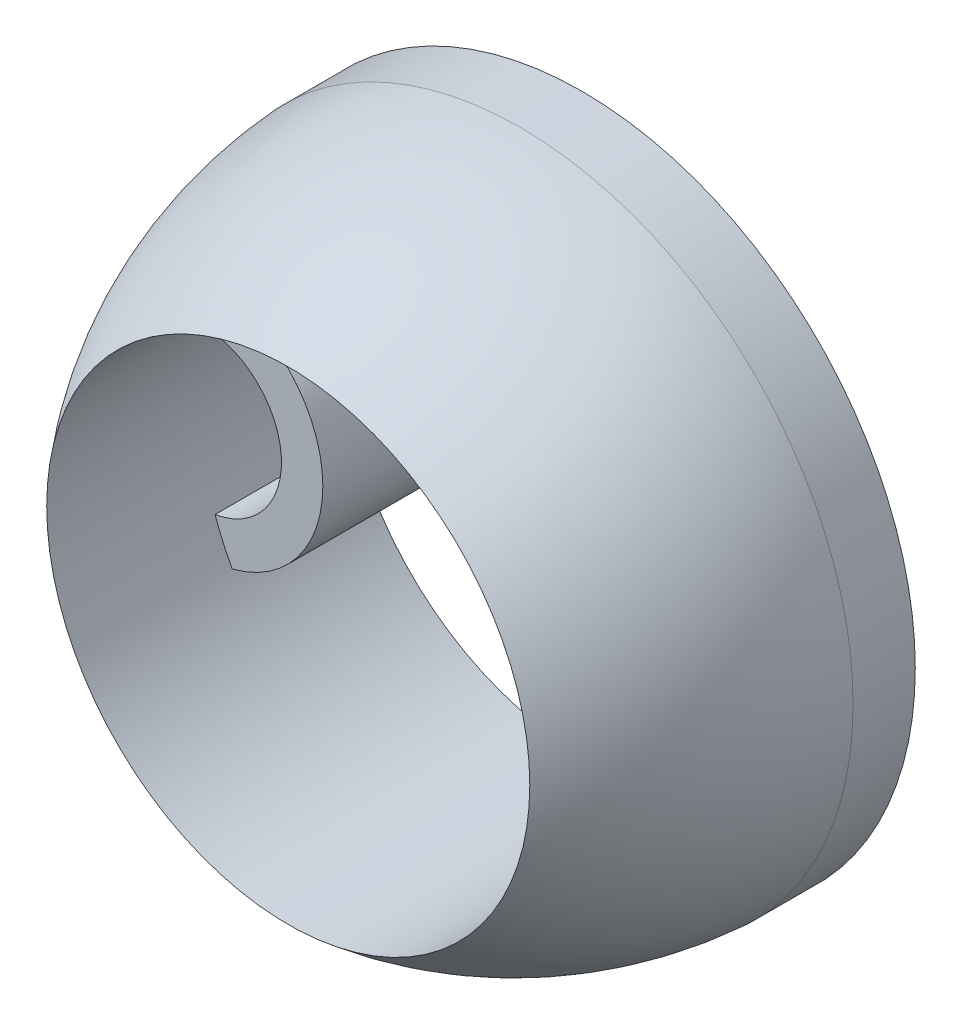
from build123d import *

# Parameters (mm, degrees)
SKETCH4_R           = 14.82725
CUT_EXTRUDE2_DEPTH  = 47.51766397
EXTRUDE_THIN1_DEPTH = 8.509


with BuildPart() as part:
    # Sketch1 → Revolve1 (revolve)
    with BuildSketch(Plane(origin=(0, 0, 0), x_dir=(1, 0, 0), z_dir=(0, 1, 0))):
        with BuildLine():
            Line((-8.741518228, 3.389570958), (-8.741518228, -0.427226446))
            ThreePointArc((-8.741518228, -0.427226446), (-2.478936495, -15.402502765), (11.705481772, -23.294340903))
            Line((11.705481772, -23.294340903), (11.705481772, 3.389570958))
            Line((11.705481772, 3.389570958), (-8.741518228, 3.389570958))
        make_face()
    revolve(axis=Axis((11.705481772, 0, -3.389570958), (0, 0, 1)))

    # Sketch4 → Cut-Extrude2 (cut, through all)
    with BuildSketch(Plane(origin=(0, 0, -3.389570958), x_dir=(-1, 0, 0), z_dir=(0, 0, -1))):
        with Locations((-11.705481772, 0)):
            Circle(SKETCH4_R)
    extrude(amount=-CUT_EXTRUDE2_DEPTH, mode=Mode.SUBTRACT)

    # Sketch5 → Extrude-Thin1 (add)
    with BuildSketch(Plane(origin=(0, 0, -3.389570958), x_dir=(-1, 0, 0), z_dir=(0, 0, -1))):
        with BuildLine():
            ThreePointArc((2.320448494, 4.808390867), (-1.752935461, 0), (2.320448494, -4.808390867))
            Line((2.320448494, -4.808390867), (1.902914987, -7.313838087))
            ThreePointArc((1.902914987, -7.313838087), (-4.292935461, 0), (1.902914987, 7.313838087))
            Line((1.902914987, 7.313838087), (2.320448494, 4.808390867))
        make_face()
    extrude(amount=-EXTRUDE_THIN1_DEPTH)


solid = part.part
